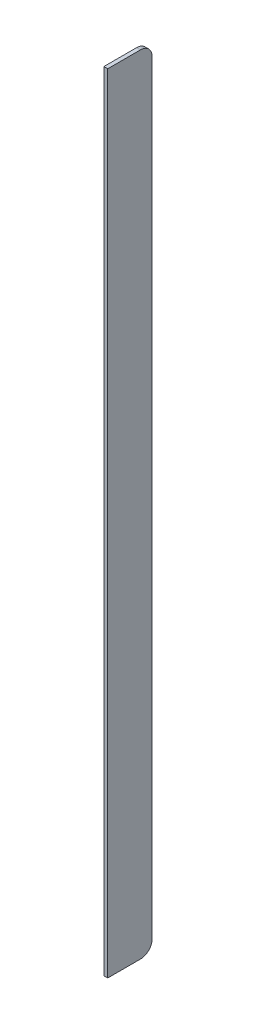
from build123d import *

# Parameters (mm, degrees)
BOSS_EXTRUDE1_DEPTH = 1


with BuildPart() as part:
    # Sketch1 → Boss-Extrude1 (new body)
    with BuildSketch(Plane(origin=(-48, 0, 0), x_dir=(0, -1, 0), z_dir=(-1, 0, 0))):
        with BuildLine():
            Line((-99, -47), (99, -47))
            ThreePointArc((99, -47), (101.121320344, -46.121320344), (102, -44))
            Line((102, -44), (102, -35.5))
            Line((102, -35.5), (-102, -35.5))
            Line((-102, -35.5), (-102, -44))
            ThreePointArc((-102, -44), (-101.121320344, -46.121320344), (-99, -47))
        make_face()
    extrude(amount=-BOSS_EXTRUDE1_DEPTH)


solid = part.part
